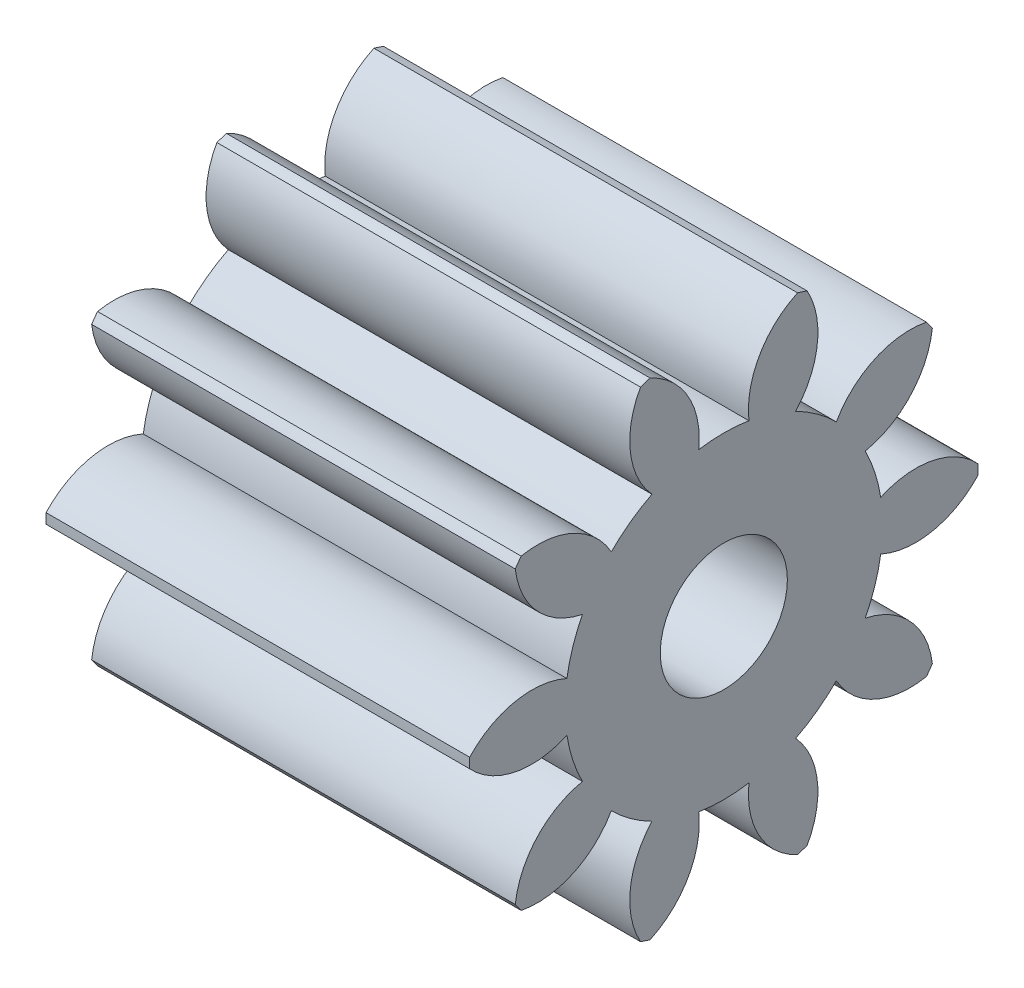
from build123d import *

# Parameters (mm, degrees)
BASPROSKE_W        = 10
BASPROSKE_H        = 6
TOOTHCUT_DEPTH     = 14.114877049
TEETHCUTS_COUNT    = 10
TEETHCUTS_ANGLE    = 324
BORSKE_R           = 0.4
BORE_DEPTH         = 50.0000508
SKETCH1_R          = 1.5
CUT_EXTRUDE1_DEPTH = 13.998849476


with BuildPart() as part:
    # BasProSke → Base-Revolve (revolve)
    with BuildSketch(Plane(origin=(0, 0, 0), x_dir=(1, 0, 0), z_dir=(0, 1, 0)), mode=Mode.PRIVATE) as base_revolve_sk:
        with Locations((5, 3)):
            Rectangle(BASPROSKE_W, BASPROSKE_H)
    revolve(base_revolve_sk.sketch.rotate(Axis((-10, 0, 0), (1, 0, 0)), 180), axis=Axis((-10, 0, 0), (1, 0, 0)))

    # TooCutSke → ToothCut (cut, through all)
    with BuildSketch(Plane(origin=(0, 0, 0), x_dir=(0, 0, -1), z_dir=(1, 0, 0))):
        with BuildLine():
            ThreePointArc((0.59278292, 3.701838653), (0, 3.749), (-0.59278292, 3.701838653))
            ThreePointArc((-0.59278292, 3.701838653), (-0.846593509, 4.924114224), (-1.775771316, 5.757784417))
            ThreePointArc((-1.775771316, 5.757784417), (0, 6.0254), (1.775771316, 5.757784417))
            ThreePointArc((1.775771316, 5.757784417), (0.846593509, 4.924114224), (0.59278292, 3.701838653))
        make_face()
    toothcut = extrude(amount=TOOTHCUT_DEPTH, mode=Mode.SUBTRACT)

    # TeethCuts: ToothCut ×10 about axis
    teethcuts_axis = Axis((-10, 0, 0), (1, 0, 0))
    for i in range(1, TEETHCUTS_COUNT):
        add(toothcut.rotate(teethcuts_axis, i * TEETHCUTS_ANGLE / (TEETHCUTS_COUNT - 1)), mode=Mode.SUBTRACT)

    # BorSke → Bore (cut, symmetric)
    with BuildSketch(Plane(origin=(0, 0, 0), x_dir=(0, 0, -1), z_dir=(1, 0, 0))):
        with Locations(Location((0, 0, 0), (0, 0, 180))):
            Circle(BORSKE_R)
    extrude(amount=BORE_DEPTH, both=True, mode=Mode.SUBTRACT)

    # Sketch1 → Cut-Extrude1 (cut, through all)
    with BuildSketch(Plane(origin=(10, 0, 0), x_dir=(0, 0, -1), z_dir=(1, 0, 0))):
        Circle(SKETCH1_R)
    extrude(amount=-CUT_EXTRUDE1_DEPTH, mode=Mode.SUBTRACT)


solid = part.part
